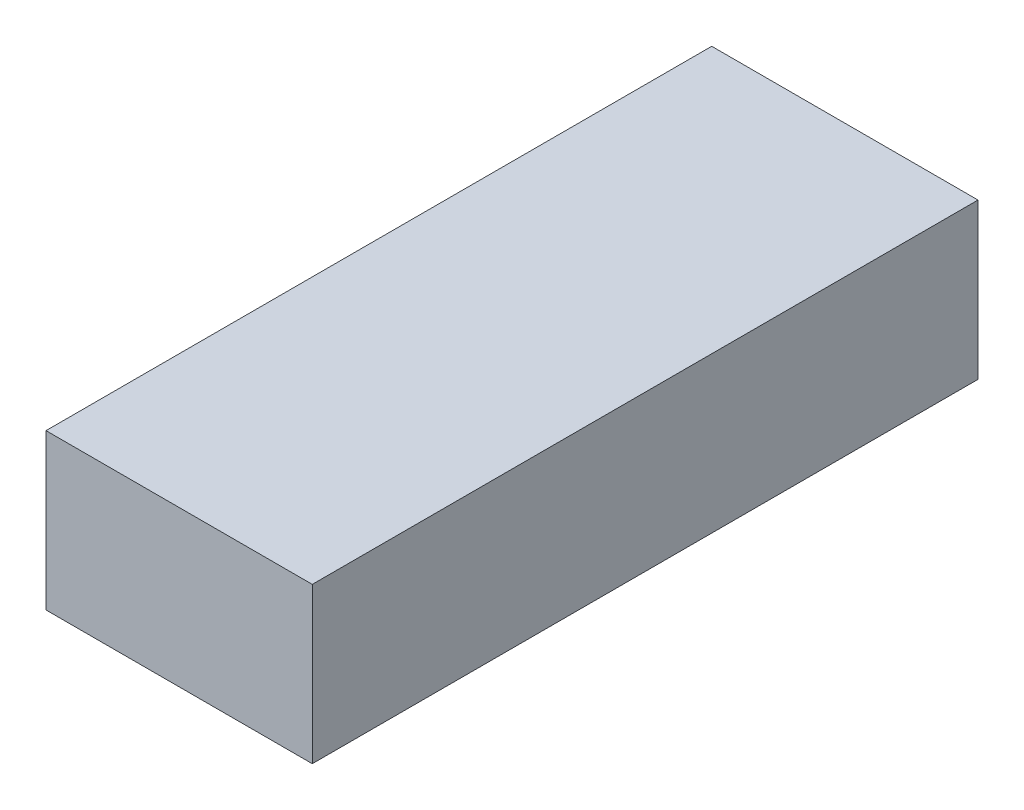
from build123d import *

# Parameters (mm, degrees)
SKETCH1_W           = 304.8
SKETCH1_H           = 177.8
BOSS_EXTRUDE1_DEPTH = 762


with BuildPart() as part:
    # Sketch1 → Boss-Extrude1 (new body)
    with BuildSketch(Plane.XY):
        Rectangle(SKETCH1_W, SKETCH1_H)
    extrude(amount=BOSS_EXTRUDE1_DEPTH)


solid = part.part
